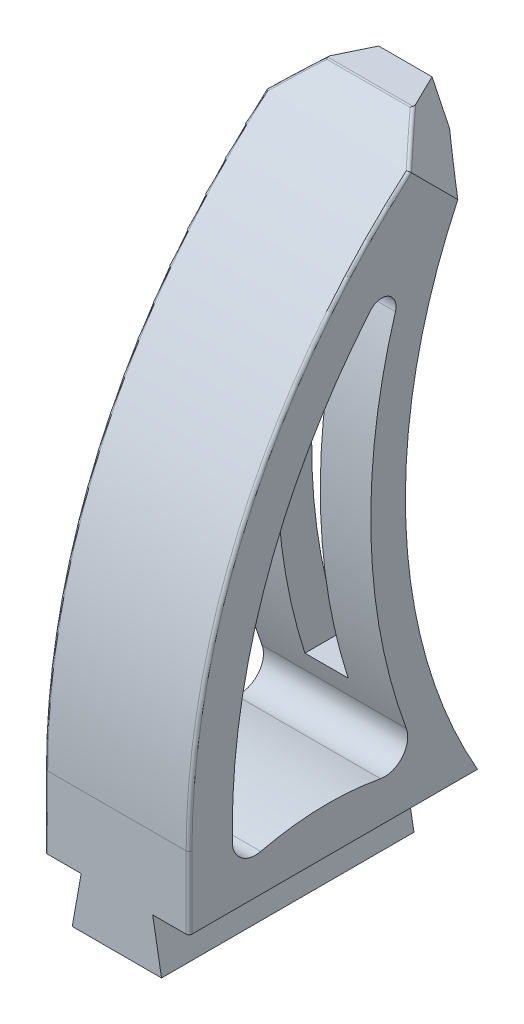
from build123d import *

# Parameters (mm, degrees)
BOSS_EXTRUDE1_DEPTH   = 12.7
KES_EKSTR_ZYON1_DEPTH = 22.86
SKETCH3_W             = 3.175
SKETCH3_H             = 4.501579944
KES_EKSTR_ZYON2_DEPTH = 22.86
KES_EKSTR_ZYON3_DEPTH = 22.86
KES_EKSTR_ZYON4_DEPTH = 11.43
RADYUS1_R             = 2.032
RADYUS2_R             = 1.27
IZIM2_W               = 3.81
IZIM2_H               = 25.4
KES_EKSTR_ZYON5_DEPTH = 22.86
IZIM3_W               = 8.451203014
IZIM3_H               = 0.1524
KES_EKSTR_ZYON6_DEPTH = 22.86
KES_EKSTR_ZYON7_DEPTH = 22.86
KES_EKSTR_ZYON8_DEPTH = 22.86
RADYUS3_R             = 0.254


with BuildPart() as part:
    # Sketch1 → Boss-Extrude1 (new, symmetric)
    with BuildSketch(Plane.XY):
        Polygon((-3.96875, 0), (3.96875, 0), (3.175, 4.501579944), (6.35, 4.501579944), (6.35, 55.301579944), (-6.35, 55.301579944), (-6.35, 4.501579944), (-3.175, 4.501579944), align=None)
    extrude(amount=BOSS_EXTRUDE1_DEPTH, both=True)

    # Sketch2 → Kes-Ekstrüzyon1 (cut)
    with BuildSketch(Plane(origin=(6.35, 0, 0), x_dir=(0, 0, -1), z_dir=(1, 0, 0))):
        with BuildLine():
            Line((9.525, 55.301579944), (-12.7, 55.301579944))
            Line((-12.7, 55.301579944), (-12.7, 10.851579944))
            ThreePointArc((-12.7, 10.851579944), (-6.8341108, 35.699885344), (9.525, 55.301579944))
        make_face()
    extrude(amount=-KES_EKSTR_ZYON1_DEPTH, mode=Mode.SUBTRACT)

    # Sketch3 → Kes-Ekstrüzyon2 (cut)
    with BuildSketch(Plane(origin=(6.35, 0, 0), x_dir=(0, 0, -1), z_dir=(1, 0, 0))):
        with Locations((11.1125, 2.250789972)):
            Rectangle(SKETCH3_W, SKETCH3_H)
    extrude(amount=-KES_EKSTR_ZYON2_DEPTH, mode=Mode.SUBTRACT)

    # Sketch4 → Kes-Ekstrüzyon3 (cut)
    with BuildSketch(Plane(origin=(6.35, 0, 0), x_dir=(0, 0, -1), z_dir=(1, 0, 0))):
        with BuildLine():
            Line((12.7, 52.126579944), (12.7, 4.501579944))
            ThreePointArc((12.7, 4.501579944), (6.35, 28.314079944), (12.7, 52.126579944))
        make_face()
    extrude(amount=-KES_EKSTR_ZYON3_DEPTH, mode=Mode.SUBTRACT)

    # Çizim1 → Kes-Ekstrüzyon4 (cut, symmetric)
    with BuildSketch(Plane(origin=(0, 0, 0), x_dir=(0, 0, -1), z_dir=(1, 0, 0))):
        with BuildLine():
            Line((-8.89, 10.851579944), (-8.89, 7.041579944))
            ThreePointArc((-8.89, 7.041579944), (-0.463388354, 8.480106364), (7.963223293, 7.041579944))
            ThreePointArc((7.963223293, 7.041579944), (3.304329022, 27.827298707), (7.564597424, 48.698367522))
            ThreePointArc((7.564597424, 48.698367522), (-4.598410017, 31.486096575), (-8.89, 10.851579944))
        make_face()
    extrude(amount=KES_EKSTR_ZYON4_DEPTH, both=True, mode=Mode.SUBTRACT)

    # Radyus1
    radyus1_edges = [part.edges().sort_by_distance(p)[0] for p in [
        (0, 7.041579944, -7.963223293),
        (0, 7.041579944, 8.89),
    ]]
    fillet(radyus1_edges, radius=RADYUS1_R)

    # Radyus2
    radyus2_edges = [part.edges().sort_by_distance(p)[0] for p in [
        (0, 48.698367522, -7.564597424),
    ]]
    fillet(radyus2_edges, radius=RADYUS2_R)

    # Çizim2 → Kes-Ekstrüzyon5 (cut)
    with BuildSketch(Plane.XY.offset(-2.54)):
        with Locations((0, 25.4)):
            Rectangle(IZIM2_W, IZIM2_H)
    extrude(amount=-KES_EKSTR_ZYON5_DEPTH, mode=Mode.SUBTRACT)

    # Çizim3 → Kes-Ekstrüzyon6 (cut)
    with BuildSketch(Plane(origin=(0, 0, -9.525), x_dir=(-1, 0, 0), z_dir=(0, 0, -1))):
        Rectangle(IZIM3_W, IZIM3_H)
    extrude(amount=-KES_EKSTR_ZYON6_DEPTH, mode=Mode.SUBTRACT)

    # Çizim4 → Kes-Ekstrüzyon7 (cut)
    with BuildSketch(Plane(origin=(0, 0, -9.525), x_dir=(-1, 0, 0), z_dir=(0, 0, -1))):
        Polygon((3.149208164, 4.501579944), (3.943735883, -0.004410664), (3.96875, 0), (3.175, 4.501579944), align=None)
        Polygon((-3.943735883, -0.004410664), (-3.149985883, 4.497169281), (-3.149208164, 4.501579944), (-3.175, 4.501579944), (-3.96875, 0), align=None)
    extrude(amount=-KES_EKSTR_ZYON7_DEPTH, mode=Mode.SUBTRACT)

    # Çizim7 → Kes-Ekstrüzyon8 (cut)
    with BuildSketch(Plane(origin=(0, 23.270981508, 23.270981508), x_dir=(-1, 0, 0), z_dir=(0, 0.7071067811865464, 0.7071067811865488))):
        Polygon((2.349914846, -48.08437831), (8.542960799, -39.080976931), (8.542960799, -48.08437831), align=None)
        Polygon((-8.542960799, -48.08437831), (-2.349914846, -48.08437831), (-8.542960799, -39.080976931), align=None)
    extrude(amount=-KES_EKSTR_ZYON8_DEPTH, mode=Mode.SUBTRACT)

    # Radyus3
    radyus3_edges = [part.edges().sort_by_distance(p)[0] for p in [
        (6.35, 7.676579944, 12.7),
        (0, 55.301579944, -9.525),
        (-5.120609971, 54.200188902, -8.104917983),
        (5.120609971, 54.200188902, -8.104917983),
        (-6.35, 7.676579944, 12.7),
        (-6.35, 34.080615313, 7.611288466),
        (6.35, 34.080615313, 7.611288466),
    ]]
    fillet(radyus3_edges, radius=RADYUS3_R)


solid = part.part
